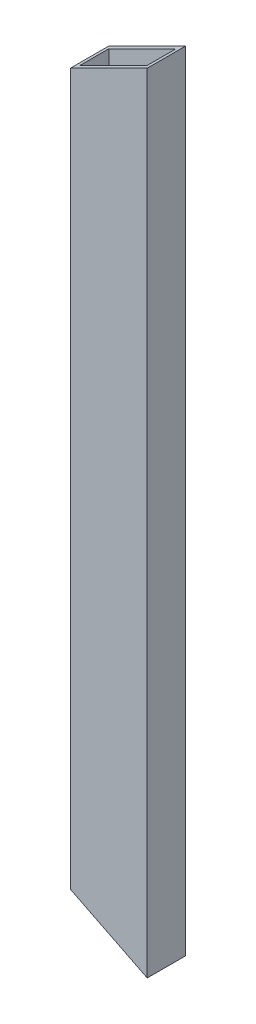
from build123d import *

# Parameters (mm, degrees)
SKETCH1_W           = 50.8
SKETCH1_H           = 25.4
SKETCH1_W_2         = 44.45
SKETCH1_H_2         = 19.05
EXTRUDE_THIN1_DEPTH = 520.7
CUT_EXTRUDE1_DEPTH  = 522.937553736


with BuildPart() as part:
    # Sketch1 → Extrude-Thin1 (new body)
    with BuildSketch(Plane(origin=(0, 0, 0), x_dir=(1, 0, 0), z_dir=(0, 1, 0))):
        Rectangle(SKETCH1_W, SKETCH1_H)
        Rectangle(SKETCH1_W_2, SKETCH1_H_2, mode=Mode.SUBTRACT)
    extrude(amount=EXTRUDE_THIN1_DEPTH)

    # Sketch2 → Cut-Extrude1 (cut, through all)
    with BuildSketch(Plane.XY.offset(12.7)):
        Polygon((25.4, 0), (-25.4, 25.4), (-25.4, 0), align=None)
        Polygon((-25.4, 520.7), (25.4, 520.7), (-25.4, 495.3), align=None)
    extrude(amount=-CUT_EXTRUDE1_DEPTH, mode=Mode.SUBTRACT)


solid = part.part
